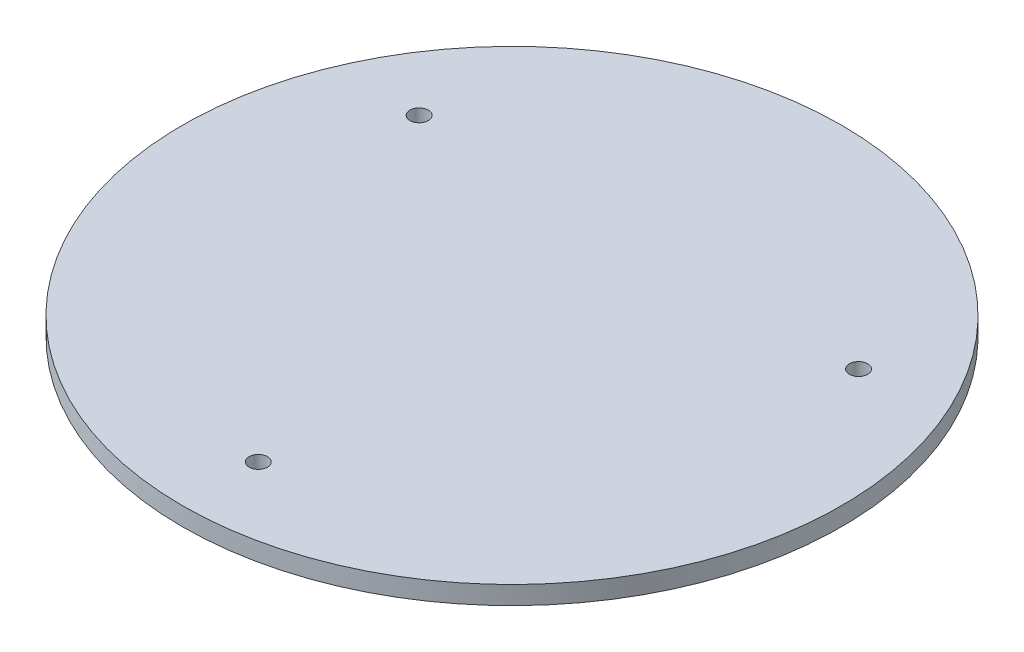
from build123d import *

# Parameters (mm, degrees)
SKETCH1_R           = 57.15
BOSS_EXTRUDE1_DEPTH = 3.175
SKETCH2_R           = 1.5875
CUT_EXTRUDE1_DEPTH  = 81.884643938


with BuildPart() as part:
    # Sketch1 → Boss-Extrude1 (new body)
    with BuildSketch(Plane(origin=(0, 0, 0), x_dir=(1, 0, 0), z_dir=(0, 1, 0))):
        with Locations(Location((0, 0, 0), (0, 0, 270))):
            Circle(SKETCH1_R)
    extrude(amount=BOSS_EXTRUDE1_DEPTH)

    # Sketch2 → Cut-Extrude1 (cut, through all)
    with BuildSketch(Plane(origin=(0, 3.175, 0), x_dir=(1, 0, 0), z_dir=(0, 1, 0))):
        with Locations(Location((0, -43.994090512, 0), (0, 0, 270))):
            Circle(SKETCH2_R)
        with Locations(Location((-38.1, 21.997045256, 0), (0, 0, 270))):
            Circle(SKETCH2_R)
        with Locations(Location((38.1, 21.997045256, 0), (0, 0, 270))):
            Circle(SKETCH2_R)
    extrude(amount=-CUT_EXTRUDE1_DEPTH, mode=Mode.SUBTRACT)


solid = part.part
